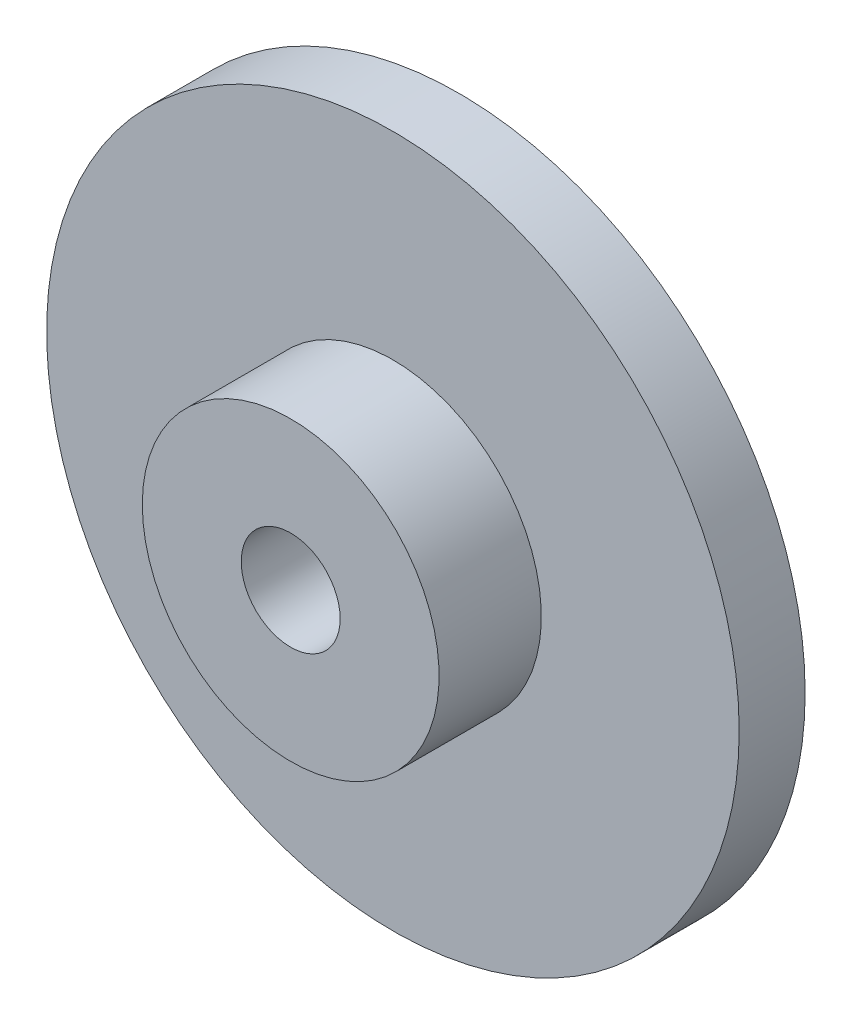
from build123d import *

# Parameters (mm, degrees)
CROQUIS1_R              = 10.5
SALIENTE_EXTRUIR1_DEPTH = 2
CROQUIS2_R              = 4.5
SALIENTE_EXTRUIR2_DEPTH = 3.1
CORTAR_EXTRUIR1_REACH   = 17.701
CROQUIS3_R              = 1.5


with BuildPart() as part:
    # Croquis1 → Saliente-Extruir1 (new body)
    with BuildSketch(Plane.XY):
        Circle(CROQUIS1_R)
    extrude(amount=SALIENTE_EXTRUIR1_DEPTH)

    # Croquis2 → Saliente-Extruir2 (add)
    with BuildSketch(Plane.XY.offset(2)):
        with Locations(Location((0, 0, 0), (0, 0, 180))):
            Circle(CROQUIS2_R)
    extrude(amount=SALIENTE_EXTRUIR2_DEPTH)

    # Croquis3 → Cortar-Extruir1 (cut, up to next)
    with BuildSketch(Plane.XY.offset(5.1), mode=Mode.PRIVATE) as cortar_extruir1_sk1:
        Circle(CROQUIS3_R)
    cortar_extruir1_tool1 = extrude(cortar_extruir1_sk1.sketch, amount=-CORTAR_EXTRUIR1_REACH, mode=Mode.PRIVATE) & part.part
    add(cortar_extruir1_tool1.solids().sort_by_distance((0, 0, 5.1))[0], mode=Mode.SUBTRACT)


solid = part.part
